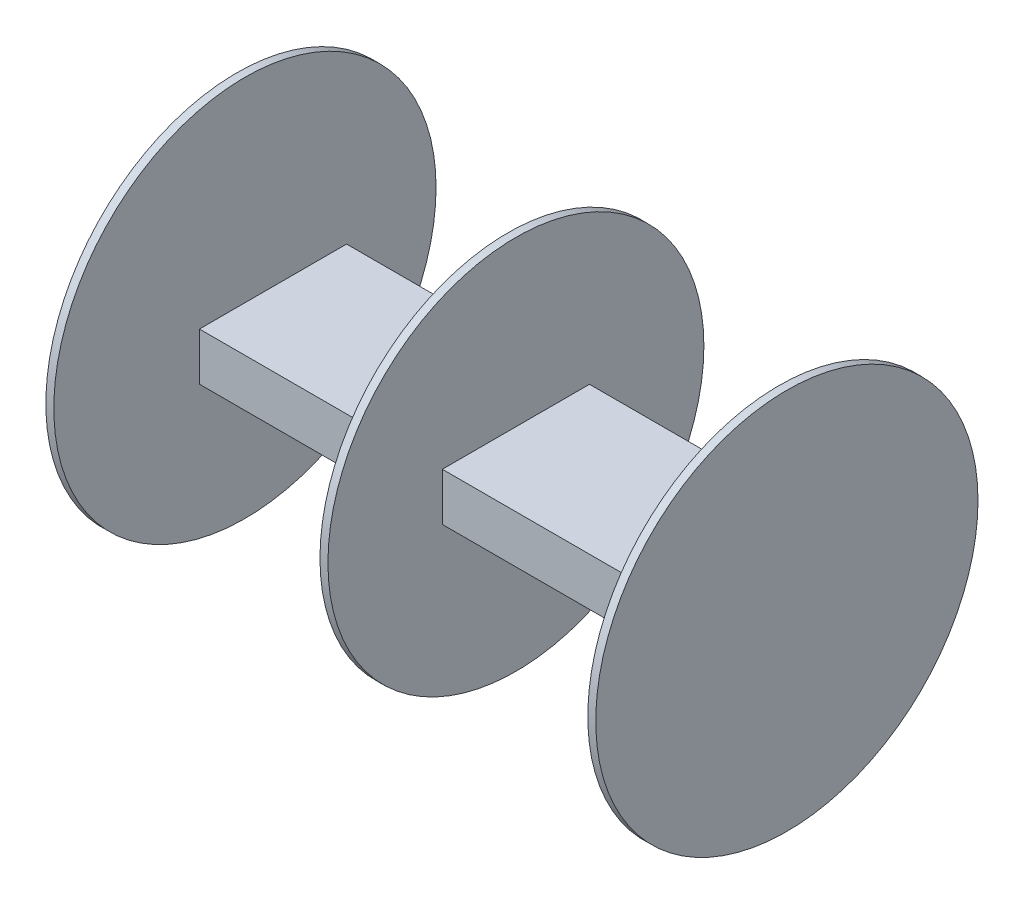
from build123d import *

# Parameters (mm, degrees)
SKETCH2_R           = 304.8
BOSS_EXTRUDE1_DEPTH = 12.7
SKETCH3_W           = 762
SKETCH3_H           = 234.666318372
BOSS_EXTRUDE2_DEPTH = 38.1
SKETCH4_R           = 299.8
BOSS_EXTRUDE3_DEPTH = 6.35


with BuildPart() as part:
    # Sketch2 → Boss-Extrude1 (new body)
    with BuildSketch(Plane(origin=(0, 0, 0), x_dir=(0, 0, -1), z_dir=(1, 0, 0))):
        Circle(SKETCH2_R)
    extrude(amount=BOSS_EXTRUDE1_DEPTH)


with BuildPart() as body_2:
    # Sketch3 → Boss-Extrude2 (new, symmetric)
    with BuildSketch(Plane(origin=(0, 0, 0), x_dir=(1, 0, 0), z_dir=(0, 1, 0))):
        with Locations((-425.796880592, 0)):
            Rectangle(SKETCH3_W, SKETCH3_H)
    extrude(amount=BOSS_EXTRUDE2_DEPTH, both=True)


with BuildPart() as body_3:
    # Sketch4 → Boss-Extrude3 (new, symmetric)
    with BuildSketch(Plane.ZY.offset(425.796880592)):
        Circle(SKETCH4_R)
    extrude(amount=BOSS_EXTRUDE3_DEPTH, both=True)


with BuildPart() as body_4:
    # Mirror1: mirrored copy
    add(part.part.mirror(Plane.ZY.offset(425.796880592)))


solid = Compound([part.part, body_2.part, body_3.part, body_4.part])
